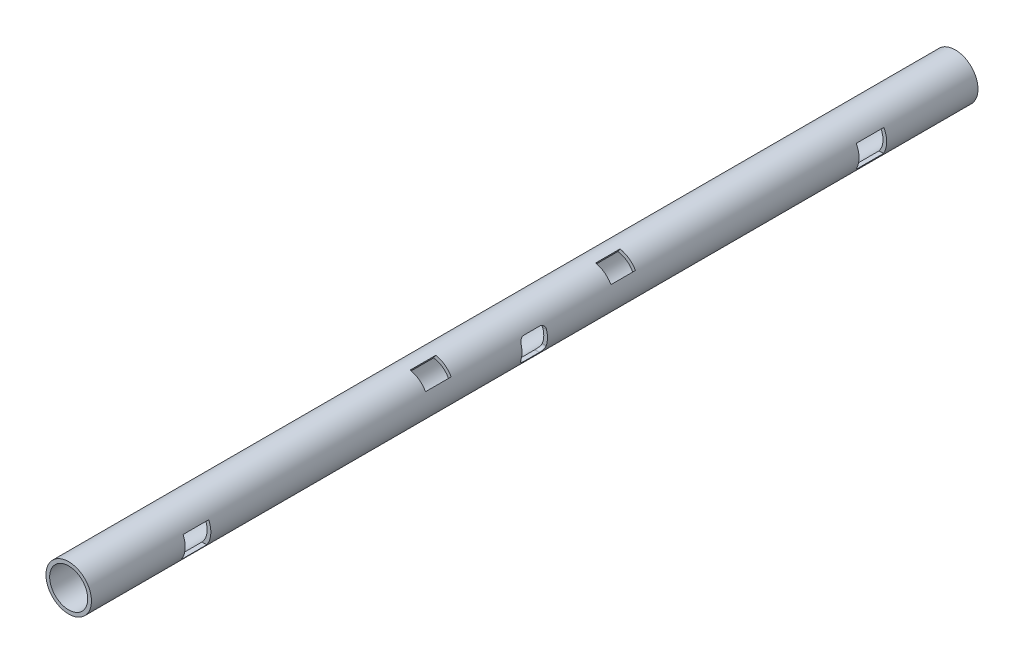
from build123d import *

# Parameters (mm, degrees)
SKETCH1_R           = 25.4
SKETCH1_R_2         = 21.261108016
BOSS_EXTRUDE1_DEPTH = 990.6
SKETCH2_W           = 28.624747861
SKETCH2_H           = 25.375038237
SKETCH2_W_2         = 30.891350897
CUT_EXTRUDE1_DEPTH  = 134.112
SKETCH4_W           = 21.111143717
SKETCH4_H           = 28.650837901
SKETCH4_H_2         = 27.348431128
CUT_EXTRUDE3_DEPTH  = 26.416
CUT_EXTRUDE4_DEPTH  = 54.864


with BuildPart() as part:
    # Sketch1 → Boss-Extrude1 (new body)
    with BuildSketch(Plane.XY):
        Circle(SKETCH1_R)
        Circle(SKETCH1_R_2, mode=Mode.SUBTRACT)
    extrude(amount=BOSS_EXTRUDE1_DEPTH)

    # Sketch2 → Cut-Extrude1 (cut)
    with BuildSketch(Plane(origin=(0, 0, 0), x_dir=(0, 0, -1), z_dir=(1, 0, 0))):
        with Locations((-871.475907431, -1.917628622)):
            Rectangle(SKETCH2_W, SKETCH2_H)
        with Locations((-117.451174558, -0.32438411)):
            Rectangle(SKETCH2_W_2, SKETCH2_H)
    extrude(amount=CUT_EXTRUDE1_DEPTH, mode=Mode.SUBTRACT)

    # Sketch4 → Cut-Extrude3 (cut)
    with BuildSketch(Plane(origin=(20.34275841, 31.325100943, 990.6), x_dir=(0.8386705679454252, -0.5446390350150252, 0), z_dir=(0.5446390350150253, 0.8386705679454253, 0))):
        with Locations((1.089203724, 391.007961831)):
            Rectangle(SKETCH4_W, SKETCH4_H)
        with Locations((1.089203724, 597.492816454)):
            Rectangle(SKETCH4_W, SKETCH4_H_2)
    extrude(amount=-CUT_EXTRUDE3_DEPTH, mode=Mode.SUBTRACT)

    # Sketch5 → Cut-Extrude4 (cut)
    with BuildSketch(Plane(origin=(54.696152621, 0, 0), x_dir=(0, 0, -1), z_dir=(1, 0, 0))):
        with BuildLine():
            Line((-504.379993857, 12.412385949), (-486.113069106, 12.412385949))
            ThreePointArc((-486.113069106, 12.412385949), (-482.520966658, 10.924488397), (-481.033069106, 7.332385949))
            Line((-481.033069106, 7.332385949), (-481.033069106, -8.595883791))
            ThreePointArc((-481.033069106, -8.595883791), (-482.520966658, -12.187986239), (-486.113069106, -13.675883791))
            Line((-486.113069106, -13.675883791), (-504.379993857, -13.675883791))
            ThreePointArc((-504.379993857, -13.675883791), (-507.972096305, -12.187986239), (-509.459993857, -8.595883791))
            Line((-509.459993857, -8.595883791), (-509.459993857, 7.332385949))
            ThreePointArc((-509.459993857, 7.332385949), (-507.972096305, 10.924488397), (-504.379993857, 12.412385949))
        make_face()
    extrude(amount=-CUT_EXTRUDE4_DEPTH, mode=Mode.SUBTRACT)


solid = part.part
